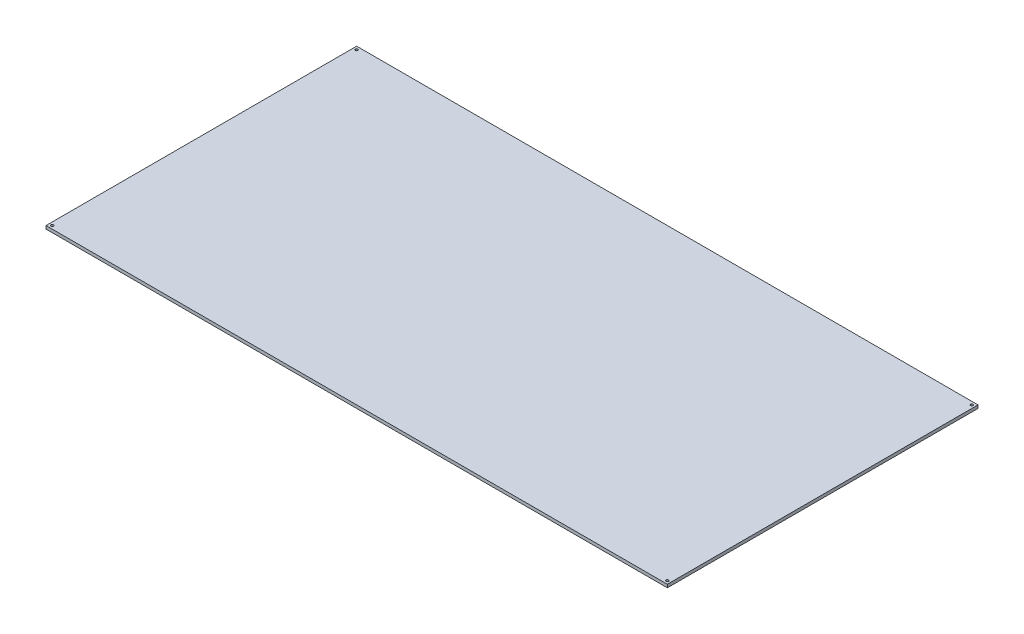
from build123d import *

# Parameters (mm, degrees)
SKETCH_1_W          = 2000
SKETCH_1_H          = 1000
EXTRUDE_1_DEPTH     = 10
SKETCH_2_R          = 4
CUT_EXTRUDE_1_DEPTH = 10


with BuildPart() as part:
    # 草图1 → 凸台-拉伸1 (new body)
    with BuildSketch(Plane(origin=(0, 0, 0), x_dir=(1, 0, 0), z_dir=(0, 1, 0))):
        with Locations((28.294417173, -45.202770246)):
            Rectangle(SKETCH_1_W, SKETCH_1_H)
    extrude(amount=EXTRUDE_1_DEPTH)

    # 草图2 → 切除-拉伸1 (cut)
    with BuildSketch(Plane(origin=(0, 10, 0), x_dir=(1, 0, 0), z_dir=(0, 1, 0))):
        with Locations(Location((-961.705582827, 444.797229754, 0), (0, 0, 270))):
            Circle(SKETCH_2_R)
        with Locations(Location((1018.294417173, 444.797229754, 0), (0, 0, 270))):
            Circle(SKETCH_2_R)
        with Locations(Location((1018.294417173, -535.202770246, 0), (0, 0, 270))):
            Circle(SKETCH_2_R)
        with Locations(Location((-961.705582827, -535.202770246, 0), (0, 0, 270))):
            Circle(SKETCH_2_R)
    extrude(amount=-CUT_EXTRUDE_1_DEPTH, mode=Mode.SUBTRACT)


solid = part.part
